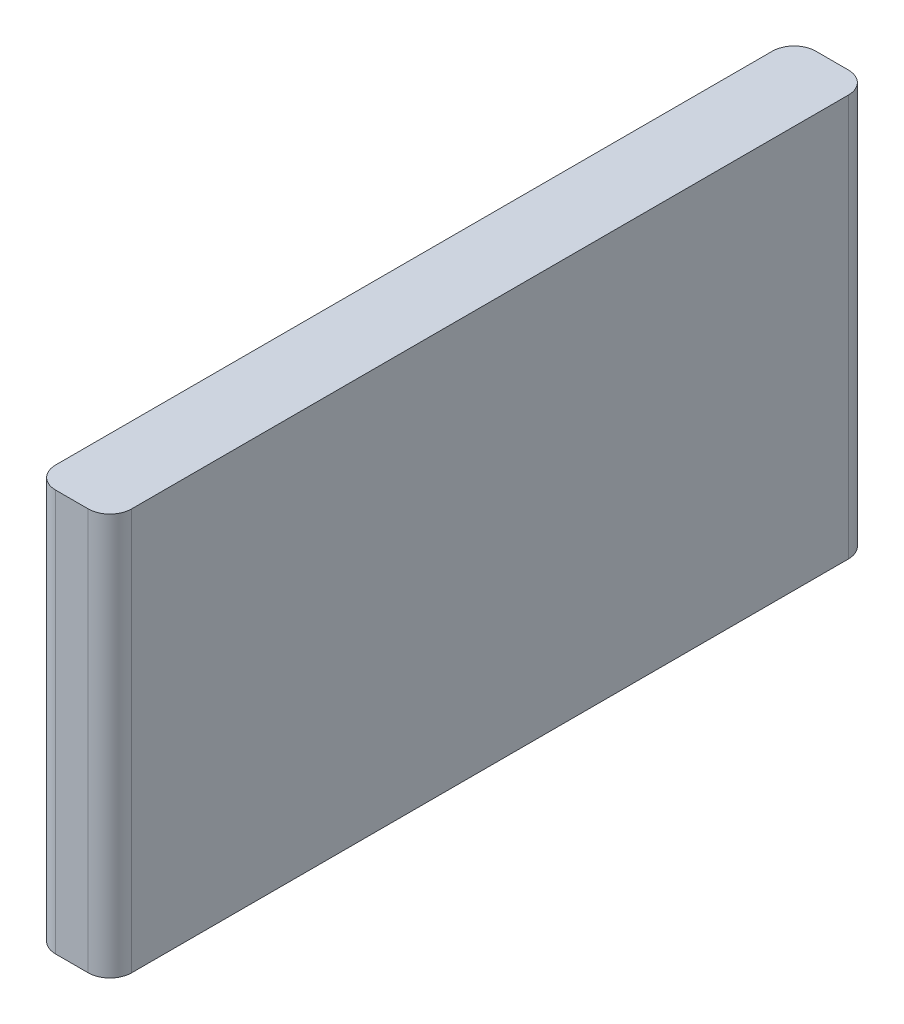
from build123d import *

# Parameters (mm, degrees)
SKETCH1_W           = 70
SKETCH1_H           = 37
BOSS_EXTRUDE1_DEPTH = 7
FILLET1_R           = 2


with BuildPart() as part:
    # Sketch1 → Boss-Extrude1 (new body)
    with BuildSketch(Plane(origin=(0, 0, 0), x_dir=(0, 0, -1), z_dir=(1, 0, 0))):
        with Locations((35, 18.5)):
            Rectangle(SKETCH1_W, SKETCH1_H)
    extrude(amount=BOSS_EXTRUDE1_DEPTH)

    # Fillet1
    fillet1_edges = [part.edges().sort_by_distance(p)[0] for p in [
        (7, 18.5, -70),
        (7, 18.5, 0),
        (0, 18.5, -70),
        (0, 18.5, 0),
    ]]
    fillet(fillet1_edges, radius=FILLET1_R)


solid = part.part
